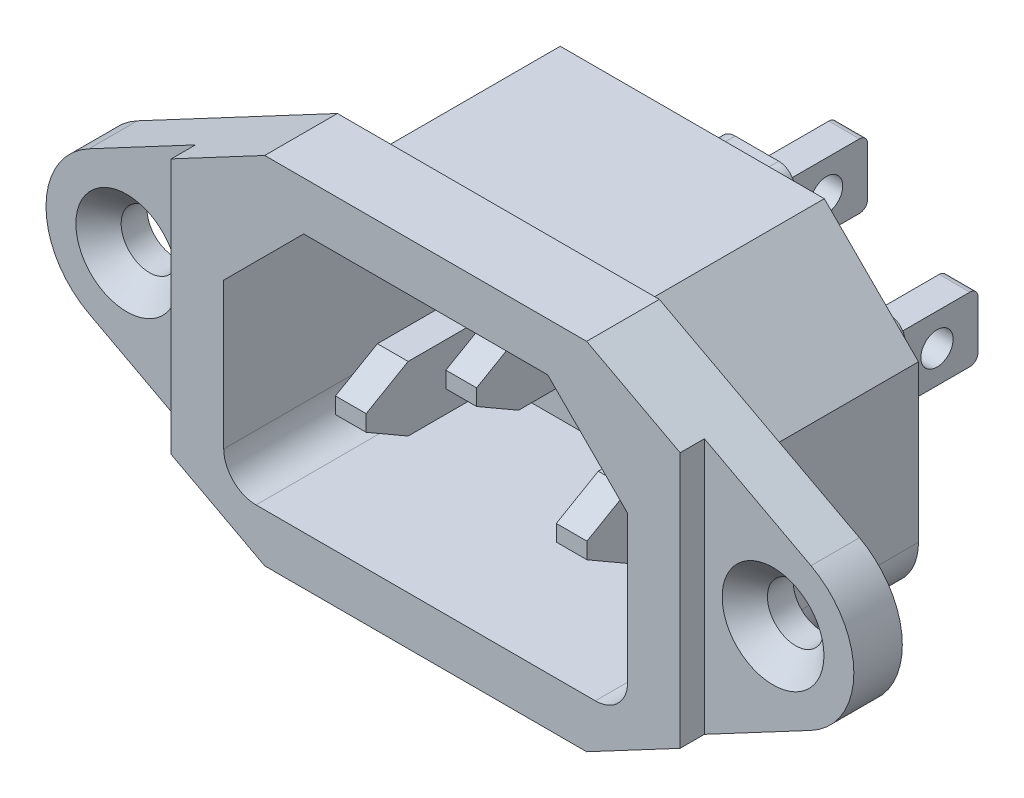
from build123d import *

# Parameters (mm, degrees)
SKETCH1_R                  = 1.75
BOSS_EXTRUDE1_DEPTH        = 3
BOSS_EXTRUDE2_START        = 1.5
BOSS_EXTRUDE2_DEPTH        = 1.5
BOSS_EXTRUDE3_DEPTH        = 15
BOSS_EXTRUDE4_START        = -2.5
BOSS_EXTRUDE4_DEPTH        = 2.5
CHAMFER2_SIZE              = 1.4
SKETCH4_W                  = 1.9
SKETCH4_H                  = 4
BOSS_EXTRUDE5_DEPTH        = 4
SKETCH4_2_W                = 1.9
SKETCH4_2_H                = 4
CUT_EXTRUDE1_DEPTH         = 32.910029771
BOSS_EXTRUDE6_DEPTH        = 9.9
BOSS_EXTRUDE6_DEPTH_BACK   = 14.3
SKETCH4_3_W                = 1.9
SKETCH4_3_H                = 4
BOSS_EXTRUDE6_2_DEPTH      = 9.9
BOSS_EXTRUDE6_2_DEPTH_BACK = 14.3
BOSS_EXTRUDE6_3_DEPTH      = 9.9
BOSS_EXTRUDE6_3_DEPTH_BACK = 14.3
FILLET1_R                  = 0.5
FILLET2_R                  = 0.5
FILLET3_R                  = 0.5
CUT_EXTRUDE2_DEPTH         = 37.959572508
CUT_EXTRUDE2_DEPTH_BACK    = 37.959572508
SKETCH5_R                  = 1
CHAMFER3_SIZE              = 1.5
CHAMFER3_SIZE2             = 2.598076211
CHAMFER4_SIZE              = 1.5
CHAMFER4_SIZE2             = 2.598076211
CHAMFER5_SIZE              = 1.5
CHAMFER5_SIZE2             = 2.598076211


with BuildPart() as part:
    # Sketch1 → Boss-Extrude1 (new body)
    # profile 1 of 3: a face of its own
    with BuildSketch(Plane.XY):
        with BuildLine():
            Line((15.75, 7.922615338), (9.962281222, 11))
            Line((9.962281222, 11), (0, 11))
            Line((0, 11), (0, 9.5))
            Line((0, 9.5), (8.171572875, 9.5))
            Line((8.171572875, 9.5), (14, 3.671572875))
            Line((14, 3.671572875), (14, -6))
            ThreePointArc((14, -6), (12.974873734, -8.474873734), (10.5, -9.5))
            Line((10.5, -9.5), (0, -9.5))
            Line((0, -9.5), (0, -11))
            Line((0, -11), (9.962281222, -11))
            Line((9.962281222, -11), (15.75, -7.922615338))
            Line((15.75, -7.922615338), (15.75, 7.922615338))
        make_face()
    # profile 2 of 3: a face of its own
    with BuildSketch(Plane.XY):
        with BuildLine():
            Line((8.171572875, 9.5), (0, 9.5))
            Line((0, 9.5), (0, 8))
            Line((0, 8), (7.550252532, 8))
            Line((7.550252532, 8), (12.5, 3.050252532))
            Line((12.5, 3.050252532), (12.5, -6))
            ThreePointArc((12.5, -6), (11.914213562, -7.414213562), (10.5, -8))
            Line((10.5, -8), (0, -8))
            Line((0, -8), (0, -9.5))
            Line((0, -9.5), (10.5, -9.5))
            ThreePointArc((10.5, -9.5), (12.974873734, -8.474873734), (14, -6))
            Line((14, -6), (14, 3.671572875))
            Line((14, 3.671572875), (8.171572875, 9.5))
        make_face()
    # profile 3 of 3: a face of its own
    with BuildSketch(Plane.XY):
        with BuildLine():
            Line((22.347357814, 4.414737964), (15.75, 7.922615338))
            Line((15.75, 7.922615338), (15.75, -7.922615338))
            Line((15.75, -7.922615338), (22.347357814, -4.414737964))
            ThreePointArc((22.347357814, -4.414737964), (25, 0), (22.347357814, 4.414737964))
        make_face()
        with Locations((20, 0)):
            Circle(SKETCH1_R, mode=Mode.SUBTRACT)
    extrude(amount=-BOSS_EXTRUDE1_DEPTH)

    # Sketch1<3> → Boss-Extrude2 (add)
    with BuildSketch(Plane.XY.offset(BOSS_EXTRUDE2_START)):
        with BuildLine():
            Line((8.171572875, 9.5), (0, 9.5))
            Line((0, 9.5), (0, 8))
            Line((0, 8), (7.550252532, 8))
            Line((7.550252532, 8), (12.5, 3.050252532))
            Line((12.5, 3.050252532), (12.5, -6))
            ThreePointArc((12.5, -6), (11.914213562, -7.414213562), (10.5, -8))
            Line((10.5, -8), (0, -8))
            Line((0, -8), (0, -9.5))
            Line((0, -9.5), (10.5, -9.5))
            ThreePointArc((10.5, -9.5), (12.974873734, -8.474873734), (14, -6))
            Line((14, -6), (14, 3.671572875))
            Line((14, 3.671572875), (8.171572875, 9.5))
        make_face()
        with BuildLine():
            Line((15.75, 7.922615338), (9.962281222, 11))
            Line((9.962281222, 11), (0, 11))
            Line((0, 11), (0, 9.5))
            Line((0, 9.5), (8.171572875, 9.5))
            Line((8.171572875, 9.5), (14, 3.671572875))
            Line((14, 3.671572875), (14, -6))
            ThreePointArc((14, -6), (12.974873734, -8.474873734), (10.5, -9.5))
            Line((10.5, -9.5), (0, -9.5))
            Line((0, -9.5), (0, -11))
            Line((0, -11), (9.962281222, -11))
            Line((9.962281222, -11), (15.75, -7.922615338))
            Line((15.75, -7.922615338), (15.75, 7.922615338))
        make_face()
    extrude(amount=-BOSS_EXTRUDE2_DEPTH)

    # Sketch1<4> → Boss-Extrude3 (add)
    with BuildSketch(Plane.XY):
        with BuildLine():
            Line((8.171572875, 9.5), (0, 9.5))
            Line((0, 9.5), (0, 8))
            Line((0, 8), (7.550252532, 8))
            Line((7.550252532, 8), (12.5, 3.050252532))
            Line((12.5, 3.050252532), (12.5, -6))
            ThreePointArc((12.5, -6), (11.914213562, -7.414213562), (10.5, -8))
            Line((10.5, -8), (0, -8))
            Line((0, -8), (0, -9.5))
            Line((0, -9.5), (10.5, -9.5))
            ThreePointArc((10.5, -9.5), (12.974873734, -8.474873734), (14, -6))
            Line((14, -6), (14, 3.671572875))
            Line((14, 3.671572875), (8.171572875, 9.5))
        make_face()
    extrude(amount=-BOSS_EXTRUDE3_DEPTH)

    # Sketch2 → Boss-Extrude4 (add)
    with BuildSketch(Plane(origin=(0, 0, -15), x_dir=(-1, 0, 0), z_dir=(0, 0, -1)).offset(BOSS_EXTRUDE4_START)):
        with BuildLine():
            Line((0, 9.5), (-8.171572875, 9.5))
            Line((-8.171572875, 9.5), (-14, 3.671572875))
            Line((-14, 3.671572875), (-14, -6))
            ThreePointArc((-14, -6), (-12.974873734, -8.474873734), (-10.5, -9.5))
            Line((-10.5, -9.5), (0, -9.5))
            Line((0, -9.5), (0, 9.5))
        make_face()
    extrude(amount=BOSS_EXTRUDE4_DEPTH)

    # Chamfer2
    chamfer2_edges = [part.edges().sort_by_distance(p)[0] for p in [
        (18.25, 0, 0),
    ]]
    chamfer(chamfer2_edges, length=CHAMFER2_SIZE)

    # Mirror1: part across plane


with BuildPart() as part_1:
    add(part.part)
    add(part.part.mirror(Plane(origin=(0, 0, 0), x_dir=(0, 0, 1), z_dir=(1, 0, 0))))

    # Sketch4 → Boss-Extrude5 (add)
    # profile 1 of 3: a face of its own
    with BuildSketch(Plane(origin=(0, 0, -15), x_dir=(-1, 0, 0), z_dir=(0, 0, -1))):
        with BuildLine():
            Line((-1.35, 6.1), (1.35, 6.1))
            ThreePointArc((1.35, 6.1), (2.057106781, 5.807106781), (2.35, 5.1))
            Line((2.35, 5.1), (2.35, -0.3))
            ThreePointArc((2.35, -0.3), (2.057106781, -1.007106781), (1.35, -1.3))
            Line((1.35, -1.3), (-1.35, -1.3))
            ThreePointArc((-1.35, -1.3), (-2.057106781, -1.007106781), (-2.35, -0.3))
            Line((-2.35, -0.3), (-2.35, 5.1))
            ThreePointArc((-2.35, 5.1), (-2.057106781, 5.807106781), (-1.35, 6.1))
        make_face()
        with Locations((0, 2.4)):
            Rectangle(SKETCH4_W, SKETCH4_H, mode=Mode.SUBTRACT)
    # profile 2 of 3: a face of its own
    with BuildSketch(Plane(origin=(0, 0, -15), x_dir=(-1, 0, 0), z_dir=(0, 0, -1))):
        with BuildLine():
            Line((-8.184232728, 1.3), (-5.484232728, 1.3))
            ThreePointArc((-5.484232728, 1.3), (-4.777125947, 1.007106781), (-4.484232728, 0.3))
            Line((-4.484232728, 0.3), (-4.484232728, -5.1))
            ThreePointArc((-4.484232728, -5.1), (-4.777125947, -5.807106781), (-5.484232728, -6.1))
            Line((-5.484232728, -6.1), (-8.184232728, -6.1))
            ThreePointArc((-8.184232728, -6.1), (-8.891339509, -5.807106781), (-9.184232728, -5.1))
            Line((-9.184232728, -5.1), (-9.184232728, 0.3))
            ThreePointArc((-9.184232728, 0.3), (-8.891339509, 1.007106781), (-8.184232728, 1.3))
        make_face()
        with Locations((-6.834232728, -2.4)):
            Rectangle(SKETCH4_W, SKETCH4_H, mode=Mode.SUBTRACT)
    # profile 3 of 3: a face of its own
    with BuildSketch(Plane(origin=(0, 0, -15), x_dir=(-1, 0, 0), z_dir=(0, 0, -1))):
        with BuildLine():
            Line((5.484232728, 1.3), (8.184232728, 1.3))
            ThreePointArc((8.184232728, 1.3), (8.891339509, 1.007106781), (9.184232728, 0.3))
            Line((9.184232728, 0.3), (9.184232728, -5.1))
            ThreePointArc((9.184232728, -5.1), (8.891339509, -5.807106781), (8.184232728, -6.1))
            Line((8.184232728, -6.1), (5.484232728, -6.1))
            ThreePointArc((5.484232728, -6.1), (4.777125947, -5.807106781), (4.484232728, -5.1))
            Line((4.484232728, -5.1), (4.484232728, 0.3))
            ThreePointArc((4.484232728, 0.3), (4.777125947, 1.007106781), (5.484232728, 1.3))
        make_face()
        with Locations((6.834232728, -2.4)):
            Rectangle(SKETCH4_W, SKETCH4_H, mode=Mode.SUBTRACT)
    extrude(amount=BOSS_EXTRUDE5_DEPTH)

    # Sketch4<2> → Cut-Extrude1 (cut, through all)
    with BuildSketch(Plane(origin=(0, 0, -15), x_dir=(-1, 0, 0), z_dir=(0, 0, -1))):
        with Locations((-6.834232728, -2.4)):
            Rectangle(SKETCH4_2_W, SKETCH4_2_H)
        with Locations((0, 2.4)):
            Rectangle(SKETCH4_2_W, SKETCH4_2_H)
        with Locations((6.834232728, -2.4)):
            Rectangle(SKETCH4_2_W, SKETCH4_2_H)
    extrude(amount=-CUT_EXTRUDE1_DEPTH, mode=Mode.SUBTRACT)


with BuildPart() as body_2:
    # Sketch4<3> → Boss-Extrude6 (new, two sides: drawn at the far end of the back side and taken through both)
    with BuildSketch(Plane(origin=(0, 0, -15), x_dir=(-1, 0, 0), z_dir=(0, 0, -1)).offset(-BOSS_EXTRUDE6_DEPTH_BACK)):
        with Locations((-6.834232728, -2.4)):
            Rectangle(SKETCH4_3_W, SKETCH4_3_H)
    extrude(amount=BOSS_EXTRUDE6_DEPTH + BOSS_EXTRUDE6_DEPTH_BACK)

    # Fillet1
    fillet1_edges = [body_2.edges().sort_by_distance(p)[0] for p in [
        (6.834232728, -0.4, -24.9),
        (6.834232728, -4.4, -24.9),
    ]]
    fillet(fillet1_edges, radius=FILLET1_R)


with BuildPart() as body_3:
    # Sketch4<3> → Boss-Extrude6 2 (new, two sides: drawn at the far end of the back side and taken through both)
    with BuildSketch(Plane(origin=(0, 0, -15), x_dir=(-1, 0, 0), z_dir=(0, 0, -1)).offset(-BOSS_EXTRUDE6_2_DEPTH_BACK)):
        with Locations((0, 2.4)):
            Rectangle(SKETCH4_3_W, SKETCH4_3_H)
    extrude(amount=BOSS_EXTRUDE6_2_DEPTH + BOSS_EXTRUDE6_2_DEPTH_BACK)

    # Fillet2
    fillet2_edges = [body_3.edges().sort_by_distance(p)[0] for p in [
        (0, 4.4, -24.9),
        (0, 0.4, -24.9),
    ]]
    fillet(fillet2_edges, radius=FILLET2_R)


with BuildPart() as body_4:
    # Sketch4<3> → Boss-Extrude6 3 (new, two sides: drawn at the far end of the back side and taken through both)
    with BuildSketch(Plane(origin=(0, 0, -15), x_dir=(-1, 0, 0), z_dir=(0, 0, -1)).offset(-BOSS_EXTRUDE6_3_DEPTH_BACK)):
        with Locations((6.834232728, -2.4)):
            Rectangle(SKETCH4_3_W, SKETCH4_3_H)
    extrude(amount=BOSS_EXTRUDE6_3_DEPTH + BOSS_EXTRUDE6_3_DEPTH_BACK)

    # Fillet3
    fillet3_edges = [body_4.edges().sort_by_distance(p)[0] for p in [
        (-6.834232728, -0.4, -24.9),
        (-6.834232728, -4.4, -24.9),
    ]]
    fillet(fillet3_edges, radius=FILLET3_R)


with BuildPart() as cut_extrude2_tool:
    # Sketch5 → Cut-Extrude2 (new, two sides: drawn at the far end of the back side and taken through both)
    with BuildSketch(Plane(origin=(0, 0, 0), x_dir=(0, 0, -1), z_dir=(1, 0, 0)).offset(-CUT_EXTRUDE2_DEPTH_BACK)):
        with Locations((22.36, 2.4)):
            Circle(SKETCH5_R)
        with Locations((22.36, -2.4)):
            Circle(SKETCH5_R)
    extrude(amount=CUT_EXTRUDE2_DEPTH + CUT_EXTRUDE2_DEPTH_BACK)


with BuildPart() as body_2_1:
    add(body_2.part)

    # Cut-Extrude2: cut by cut_extrude2_tool
    add(cut_extrude2_tool.part, mode=Mode.SUBTRACT)

    # Chamfer5
    chamfer5_edges = [body_2_1.edges().sort_by_distance(p)[0] for p in [
        (6.834232728, -4.4, -0.7),
        (6.834232728, -0.4, -0.7),
    ]]
    chamfer5_side = [body_2_1.faces().sort_by_distance(p)[0] for p in [
        (6.834232728, -2.4, -0.7),
    ]]
    chamfer(chamfer5_edges, length=CHAMFER5_SIZE, length2=CHAMFER5_SIZE2, reference=chamfer5_side[0])


with BuildPart() as body_3_1:
    add(body_3.part)

    # Cut-Extrude2: cut by cut_extrude2_tool
    add(cut_extrude2_tool.part, mode=Mode.SUBTRACT)

    # Chamfer4
    chamfer4_edges = [body_3_1.edges().sort_by_distance(p)[0] for p in [
        (0, 0.4, -0.7),
        (0, 4.4, -0.7),
    ]]
    chamfer4_side = [body_3_1.faces().sort_by_distance(p)[0] for p in [
        (0, 2.4, -0.7),
    ]]
    chamfer(chamfer4_edges, length=CHAMFER4_SIZE, length2=CHAMFER4_SIZE2, reference=chamfer4_side[0])


with BuildPart() as body_4_1:
    add(body_4.part)

    # Cut-Extrude2: cut by cut_extrude2_tool
    add(cut_extrude2_tool.part, mode=Mode.SUBTRACT)

    # Chamfer3
    chamfer3_edges = [body_4_1.edges().sort_by_distance(p)[0] for p in [
        (-6.834232728, -4.4, -0.7),
        (-6.834232728, -0.4, -0.7),
    ]]
    chamfer3_side = [body_4_1.faces().sort_by_distance(p)[0] for p in [
        (-6.834232728, -2.4, -0.7),
    ]]
    chamfer(chamfer3_edges, length=CHAMFER3_SIZE, length2=CHAMFER3_SIZE2, reference=chamfer3_side[0])


solid = Compound([part_1.part, body_2_1.part, body_3_1.part, body_4_1.part])
